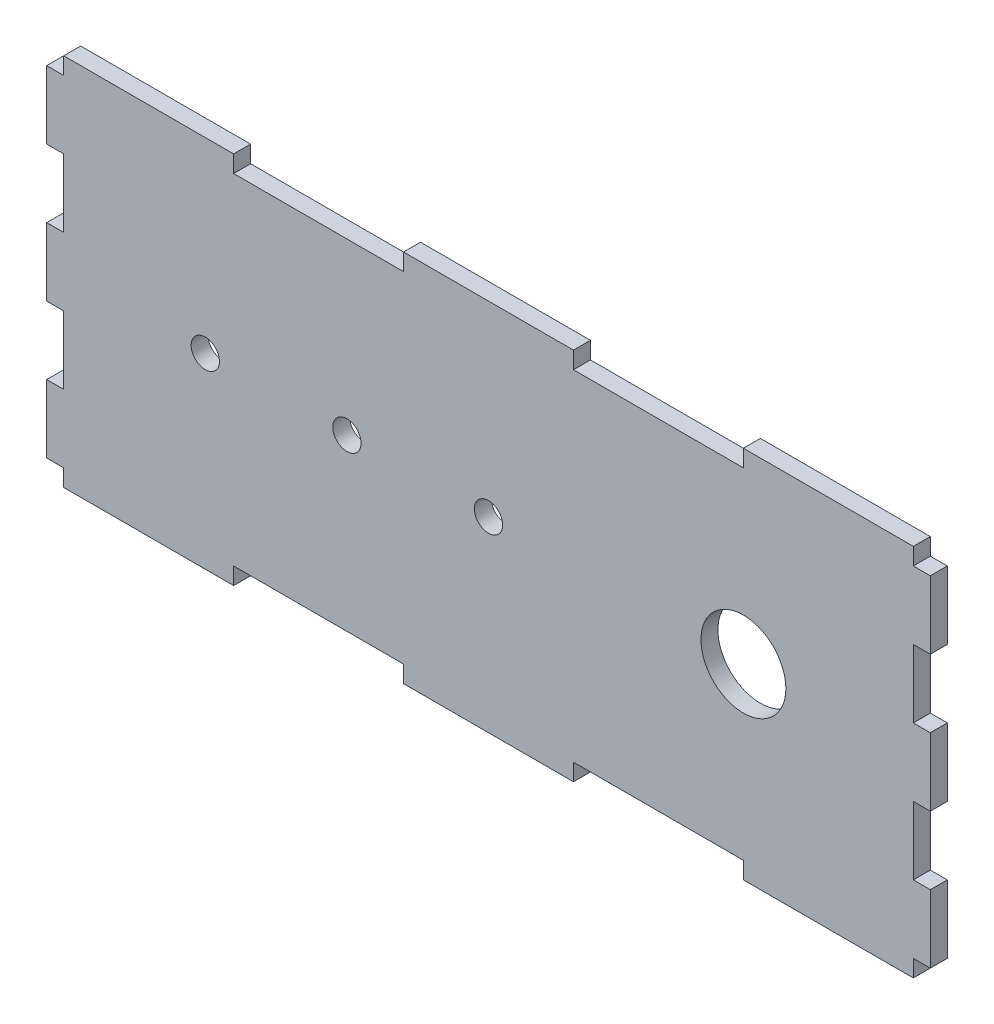
from build123d import *

# Parameters (mm, degrees)
ESBO_O1_R                = 2.5
ESBO_O1_R_2              = 7.5
RESSALTO_EXTRUS_O1_DEPTH = 3


with BuildPart() as part:
    # Esboço1 → Ressalto-extrusão1 (new body)
    with BuildSketch(Plane.XY):
        Polygon((40.700385396, -30), (10.700385396, -30), (10.700385396, -33), (-19.299614604, -33), (-19.299614604, -30), (-49.299614604, -30), (-49.299614604, -33), (-79.299614604, -33), (-79.299614604, -30), (-82.299614604, -30), (-82.299614604, -18), (-79.299614604, -18), (-79.299614604, -6), (-82.299614604, -6), (-82.299614604, 6), (-79.299614604, 6), (-79.299614604, 18), (-82.299614604, 18), (-82.299614604, 30), (-79.299614604, 30), (-79.299614604, 33), (-49.299614604, 33), (-49.299614604, 30), (-19.299614604, 30), (-19.299614604, 33), (10.700385396, 33), (10.700385396, 30), (40.700385396, 30), (40.700385396, 33), (70.700385396, 33), (70.700385396, 30), (73.700385396, 30), (73.700385396, 18), (70.700385396, 18), (70.700385396, 6), (73.700385396, 6), (73.700385396, -6), (70.700385396, -6), (70.700385396, -18), (73.700385396, -18), (73.700385396, -30), (70.700385396, -30), (70.700385396, -33), (40.700385396, -33), align=None)
        with Locations((-54.299614604, 0)):
            Circle(ESBO_O1_R, mode=Mode.SUBTRACT)
        with Locations((-29.299614604, 0)):
            Circle(ESBO_O1_R, mode=Mode.SUBTRACT)
        with Locations((-4.299614604, 0)):
            Circle(ESBO_O1_R, mode=Mode.SUBTRACT)
        with Locations((40.700385396, 0)):
            Circle(ESBO_O1_R_2, mode=Mode.SUBTRACT)
    extrude(amount=RESSALTO_EXTRUS_O1_DEPTH)


solid = part.part
